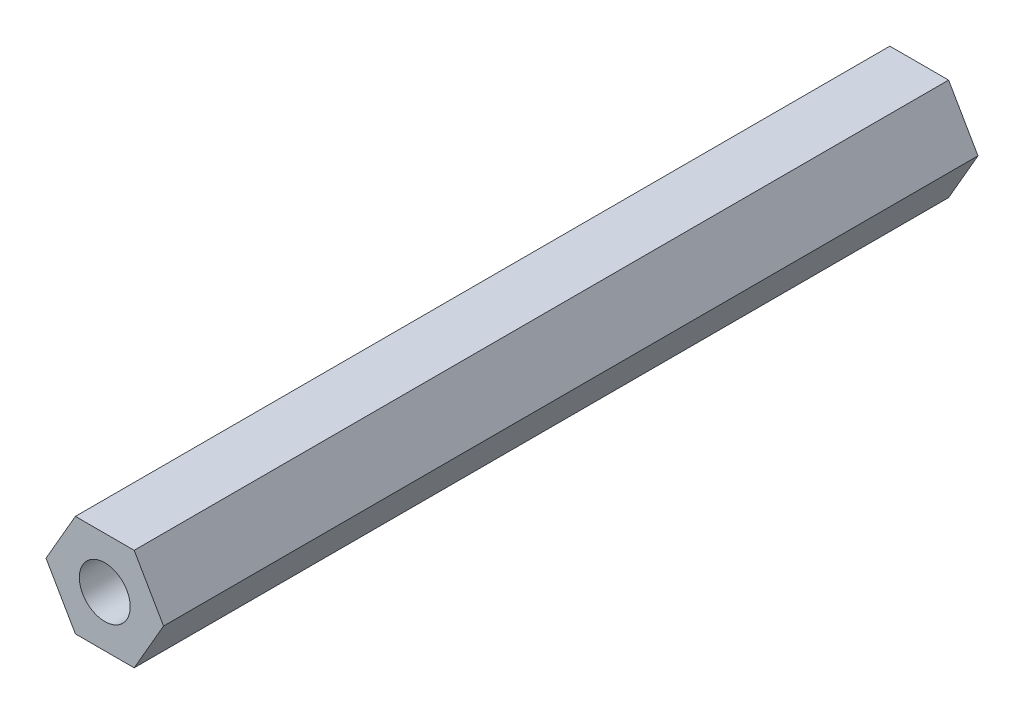
from build123d import *

# Parameters (mm, degrees)
SKETCH1_R           = 3.175
BOSS_EXTRUDE1_DEPTH = 50.8


with BuildPart() as part:
    # Sketch1 → Boss-Extrude1 (new, symmetric)
    with BuildSketch(Plane.XY):
        Polygon((3.666174209, 6.35), (-3.666174209, 6.35), (-7.332348419, 0), (-3.666174209, -6.35), (3.666174209, -6.35), (7.332348419, 0), align=None)
        Circle(SKETCH1_R, mode=Mode.SUBTRACT)
    extrude(amount=BOSS_EXTRUDE1_DEPTH, both=True)


solid = part.part
